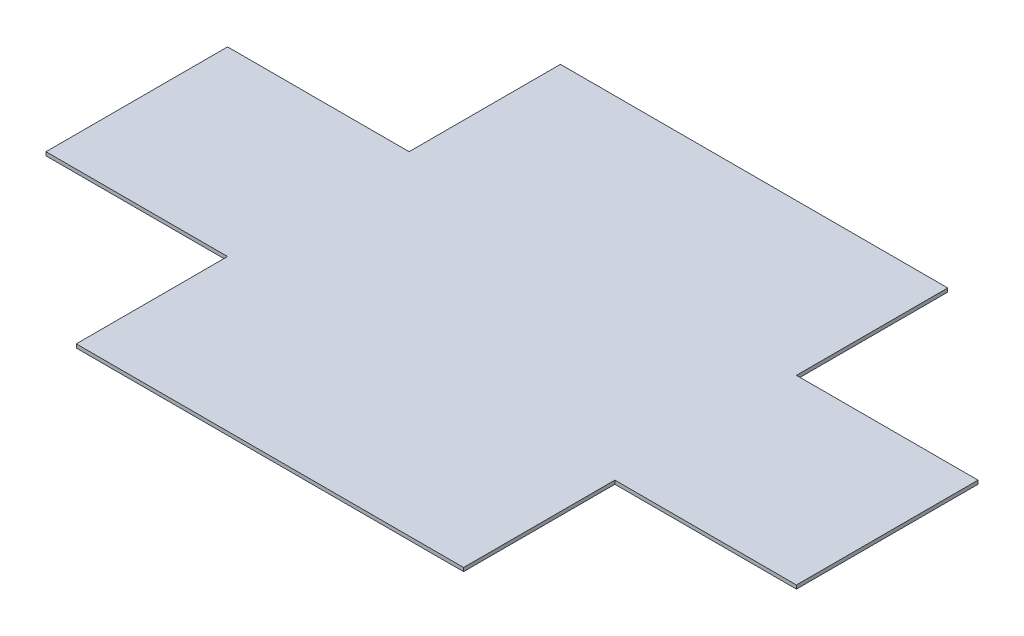
from build123d import *

# Parameters (mm, degrees)
EXTRUDE_1_DEPTH = 3


with BuildPart() as part:
    # 草图1 → 凸台-拉伸1 (new body)
    with BuildSketch(Plane(origin=(0, 0, 0), x_dir=(1, 0, 0), z_dir=(0, 1, 0))):
        Polygon((-310, -75), (-160, -75), (-160, -200), (160, -200), (160, -75), (310, -75), (310, 75), (160, 75), (160, 200), (-160, 200), (-160, 75), (-310, 75), align=None)
    extrude(amount=EXTRUDE_1_DEPTH)


solid = part.part
